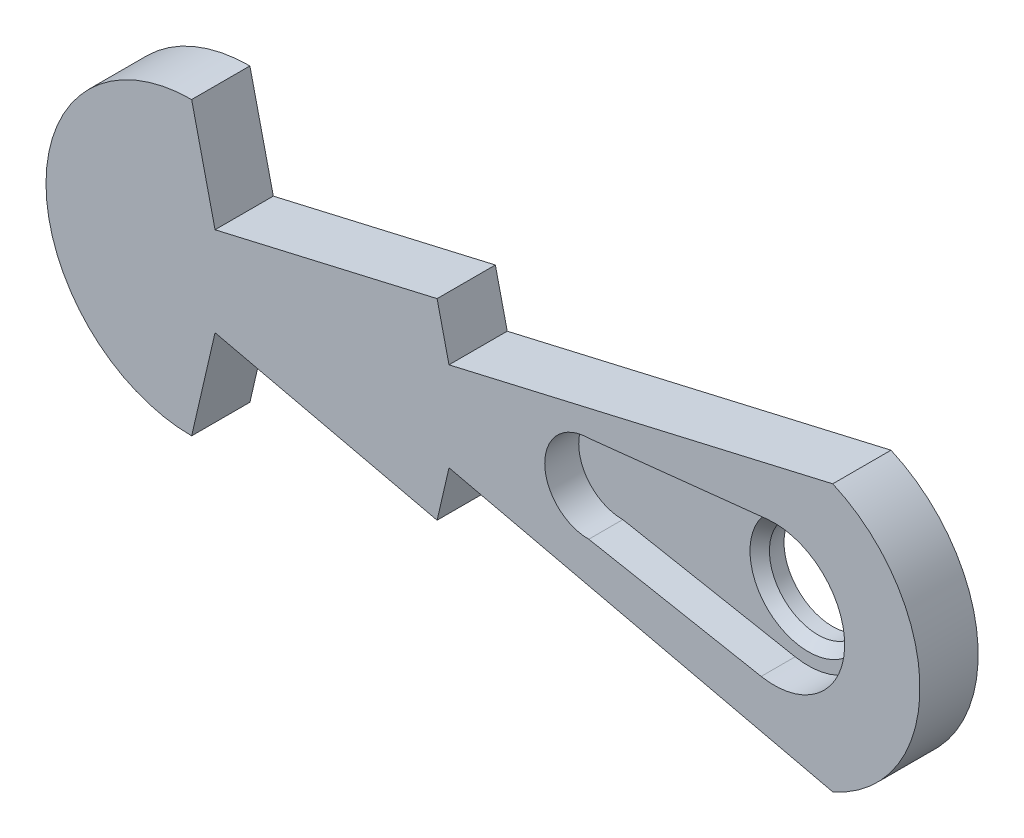
from build123d import *

# Parameters (mm, degrees)
Y_KSEKLIK_EKSTR_ZYON1_DEPTH = 4
KES_EKSTR_ZYON1_START       = -4
KES_EKSTR_ZYON1_DEPTH       = 4
IZIM3_R                     = 5
KES_EKSTR_ZYON2_DEPTH       = 4
KES_EKSTR_ZYON3_DEPTH       = 4
IZIM10_R                    = 7.25
IZIM10_R_2                  = 5
KES_EKSTR_ZYON4_DEPTH       = 3.5
IZIM11_R                    = 5
Y_KSEKLIK_EKSTR_ZYON3_DEPTH = 2
PAH2_SIZE                   = 1


with BuildPart() as part:
    # Çizim1 → Yükseklik-Ekstrüzyon1 (new body)
    with BuildSketch(Plane.XY):
        with BuildLine():
            Line((-35.653037037, 15), (24.346962963, 15))
            ThreePointArc((24.346962963, 15), (39.346962963, 0), (24.346962963, -15))
            Line((24.346962963, -15), (-35.653037037, -15))
            ThreePointArc((-35.653037037, -15), (-50.653037037, 0), (-35.653037037, 15))
        make_face()
    extrude(amount=Y_KSEKLIK_EKSTR_ZYON1_DEPTH)

    # Çizim2 → Kes-Ekstrüzyon1 (cut)
    with BuildSketch(Plane.XY.offset(4).offset(KES_EKSTR_ZYON1_START)):
        Polygon((-11.560212186, 15), (-35.653037037, 15), (-33.243754552, 4.590717515), (-10.375990279, 9.883580305), align=None)
        Polygon((-33.243754552, -4.590717515), (-35.653037037, -15), (-11.560212186, -15), (-10.375990279, -9.883580305), align=None)
        with BuildLine():
            Line((-10.375990279, 9.883580305), (-9.150929701, 4.590717515))
            Line((-9.150929701, 4.590717515), (30.369414779, 13.737906468))
            ThreePointArc((30.369414779, 13.737906468), (27.42360098, 14.681086421), (24.346962963, 15))
            Line((24.346962963, 15), (11.729453249, 15))
            Line((11.729453249, 15), (-10.375990279, 9.883580305))
        make_face()
        with BuildLine():
            Line((-9.150929701, -4.590717515), (-10.375990279, -9.883580305))
            Line((-10.375990279, -9.883580305), (11.729453249, -15))
            Line((11.729453249, -15), (24.346962963, -15))
            ThreePointArc((24.346962963, -15), (27.42360098, -14.681086421), (30.369414779, -13.737906468))
            Line((30.369414779, -13.737906468), (-9.150929701, -4.590717515))
        make_face()
    extrude(amount=KES_EKSTR_ZYON1_DEPTH, mode=Mode.SUBTRACT)


with BuildPart() as kes_ekstr_zyon1_piece_1:
    # of the separate pieces the step leaves, piece 1, a body of its own (kes_ekstr_zyon1_pieces)
    add(part.part.solids().sort_by_distance((-35.653037037, -15, 0))[0])

    # Çizim3 → Kes-Ekstrüzyon2 (cut)
    with BuildSketch(Plane.XY.offset(4)):
        with Locations((24.346962963, 0)):
            Circle(IZIM3_R)
    extrude(amount=-KES_EKSTR_ZYON2_DEPTH, mode=Mode.SUBTRACT)

    # Çizim10 → Kes-Ekstrüzyon4 (cut)
    # profile 1 of 2: a face of its own
    with BuildSketch(Plane.XY.offset(4)):
        with BuildLine():
            ThreePointArc((22.99921211, -7.123627421), (17.102780918, 0.290390243), (23.573735665, 7.20864894))
            Line((23.573735665, 7.20864894), (5.173034472, 5.234919246))
            ThreePointArc((5.173034472, 5.234919246), (0.709580704, 0.698667438), (5.245832511, -3.76478633))
            Line((5.245832511, -3.76478633), (22.99921211, -7.123627421))
        make_face()
    # profile 2 of 2: a face of its own
    with BuildSketch(Plane.XY.offset(4)):
        with Locations((24.346962963, 0)):
            Circle(IZIM10_R)
        with Locations((24.346962963, 0)):
            Circle(IZIM10_R_2, mode=Mode.SUBTRACT)
    extrude(amount=-KES_EKSTR_ZYON4_DEPTH, mode=Mode.SUBTRACT)

    # Çizim11 → Yükseklik-Ekstrüzyon3 (add)
    with BuildSketch(Plane(origin=(0, 0, 0), x_dir=(-1, 0, 0), z_dir=(0, 0, -1))):
        with BuildLine():
            Line((33.243754552, -4.590717515), (35.653037037, -15))
            ThreePointArc((35.653037037, -15), (50.653037037, 0), (35.653037037, 15))
            Line((35.653037037, 15), (33.243754552, 4.590717515))
            Line((33.243754552, 4.590717515), (10.375990279, 9.883580305))
            Line((10.375990279, 9.883580305), (9.150929701, 4.590717515))
            Line((9.150929701, 4.590717515), (-30.369414779, 13.737906468))
            ThreePointArc((-30.369414779, 13.737906468), (-39.346962963, 0), (-30.369414779, -13.737906468))
            Line((-30.369414779, -13.737906468), (9.150929701, -4.590717515))
            Line((9.150929701, -4.590717515), (10.375990279, -9.883580305))
            Line((10.375990279, -9.883580305), (33.243754552, -4.590717515))
        make_face()
        with Locations(Location((-24.346962963, 0, 0), (0, 0, 180))):
            Circle(IZIM11_R, mode=Mode.SUBTRACT)
    extrude(amount=Y_KSEKLIK_EKSTR_ZYON3_DEPTH)

    # Pah2
    pah2_edges = [kes_ekstr_zyon1_piece_1.edges().sort_by_distance(p)[0] for p in [
        (19.346962963, 0, 0.5),
    ]]
    chamfer(pah2_edges, length=PAH2_SIZE)


with BuildPart() as kes_ekstr_zyon1_piece_2:
    # of the separate pieces the step leaves, piece 2, a body of its own (kes_ekstr_zyon1_pieces)
    add(part.part.solids().sort_by_distance((-11.560212186, 15, 0))[0])


with BuildPart() as kes_ekstr_zyon1_piece_3:
    # of the separate pieces the step leaves, piece 3, a body of its own (kes_ekstr_zyon1_pieces)
    add(part.part.solids().sort_by_distance((11.729453249, -15, 0))[0])


with BuildPart() as kes_ekstr_zyon3_tool:
    # Çizim5 → Kes-Ekstrüzyon3 (new body)
    with BuildSketch(Plane.XY.offset(4)):
        Polygon((-10.375990279, -9.883580305), (-11.560212186, -15), (11.729453249, -15), align=None)
        Polygon((-11.560212186, 15), (-10.375990279, 9.883580305), (11.729453249, 15), align=None)
    extrude(amount=-KES_EKSTR_ZYON3_DEPTH)


with BuildPart() as kes_ekstr_zyon1_piece_2_1:
    add(kes_ekstr_zyon1_piece_2.part)

    # Kes-Ekstrüzyon3: cut by kes_ekstr_zyon3_tool
    add(kes_ekstr_zyon3_tool.part, mode=Mode.SUBTRACT)


with BuildPart() as kes_ekstr_zyon1_piece_3_1:
    add(kes_ekstr_zyon1_piece_3.part)

    # Kes-Ekstrüzyon3: cut by kes_ekstr_zyon3_tool
    add(kes_ekstr_zyon3_tool.part, mode=Mode.SUBTRACT)


solid = kes_ekstr_zyon1_piece_1.part
